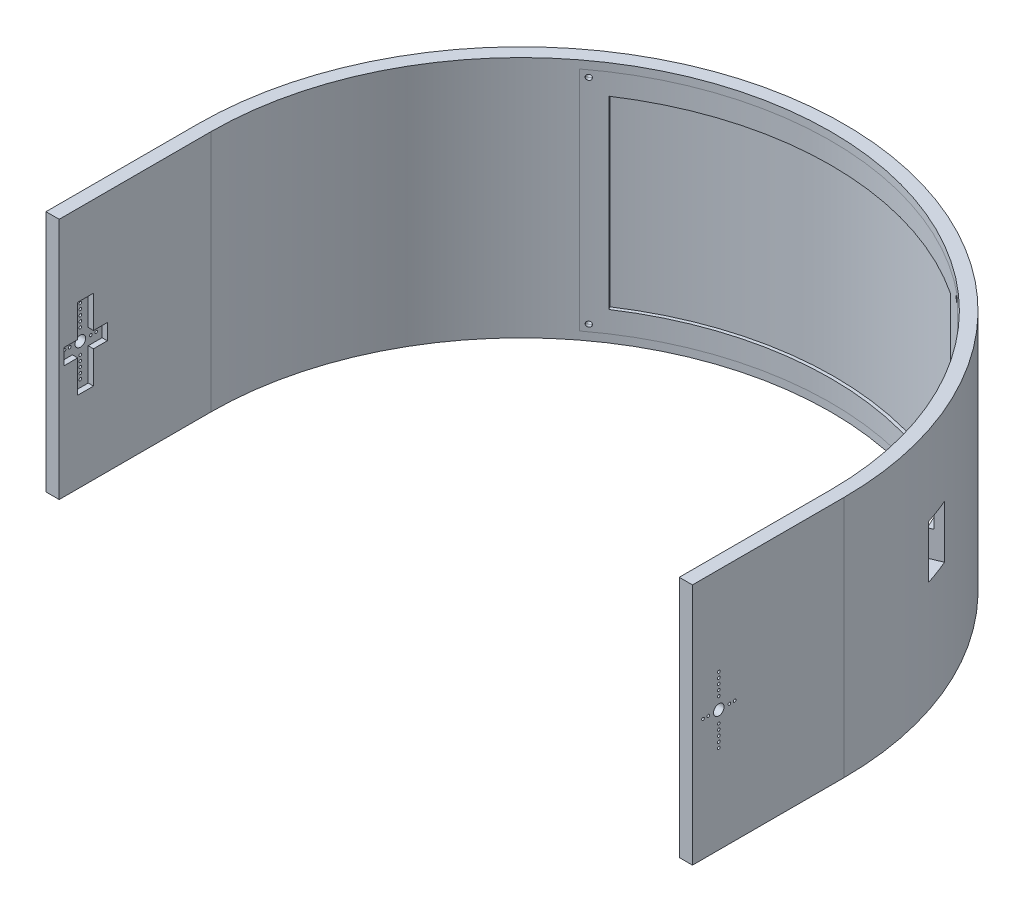
from build123d import *

# Parameters (mm, degrees)
BOSS_EXTRUDE1_DEPTH     = 46
SKETCH2_R               = 2
SKETCH2_R_2             = 0.5
CUT_EXTRUDE1_DEPTH      = 302.730011765
CUT_EXTRUDE2_START      = -2
CUT_EXTRUDE2_DEPTH      = 239
CUT_EXTRUDE3_DEPTH      = 38
CUT_EXTRUDE4_DEPTH      = 28
CUT_EXTRUDE5_DEPTH      = 10
CUT_EXTRUDE6_DEPTH      = 20
CUT_EXTRUDE7_DEPTH      = 43
CUT_EXTRUDE7_DEPTH_BACK = 43
CUT_EXTRUDE8_DEPTH      = 260.102171047
CUT_EXTRUDE8_DEPTH_BACK = 260.102171047
SKETCH9_R               = 1
CUT_EXTRUDE9_DEPTH      = 261.319003152
CUT_EXTRUDE9_DEPTH_BACK = 261.319003152
SKETCH10_R              = 1
BOSS_EXTRUDE2_START     = -43
BOSS_EXTRUDE2_DEPTH     = 86
SKETCH12_R              = 1
CUT_EXTRUDE10_DEPTH     = 260.102171148
SKETCH13_R              = 1
CUT_EXTRUDE12_DEPTH     = 261.319003152
CUT_EXTRUDE13_DEPTH     = 35


with BuildPart() as part:
    # Sketch1 → Boss-Extrude1 (new, symmetric)
    with BuildSketch(Plane(origin=(0, 0, 0), x_dir=(1, 0, 0), z_dir=(0, 1, 0))):
        with BuildLine():
            Line((-117.5, -10), (-117.5, 10))
            Line((-117.5, 10), (-117.5, 47.5))
            ThreePointArc((-117.5, 47.5), (0, 165), (117.5, 47.5))
            Line((117.5, 47.5), (117.5, 10))
            Line((117.5, 10), (117.5, -10))
            Line((117.5, -10), (122.5, -10))
            Line((122.5, -10), (122.5, 47.5))
            ThreePointArc((122.5, 47.5), (0, 170), (-122.5, 47.5))
            Line((-122.5, 47.5), (-122.5, -10))
            Line((-122.5, -10), (-117.5, -10))
        make_face()
    extrude(amount=BOSS_EXTRUDE1_DEPTH, both=True)

    # Sketch2 → Cut-Extrude1 (cut, through all)
    with BuildSketch(Plane.ZY.offset(122.5)):
        Circle(SKETCH2_R)
        with Locations((4, 0)):
            Circle(SKETCH2_R_2)
        with Locations((6, 0)):
            Circle(SKETCH2_R_2)
        with Locations((-6, 0)):
            Circle(SKETCH2_R_2)
        with Locations((-4, 0)):
            Circle(SKETCH2_R_2)
        with Locations((0, 4.5)):
            Circle(SKETCH2_R_2)
        with Locations((0, 6.5)):
            Circle(SKETCH2_R_2)
        with Locations((0, 8.5)):
            Circle(SKETCH2_R_2)
        with Locations((0, 10.5)):
            Circle(SKETCH2_R_2)
        with Locations((0, 12.5)):
            Circle(SKETCH2_R_2)
        with Locations((0, -12.5)):
            Circle(SKETCH2_R_2)
        with Locations((0, -10.5)):
            Circle(SKETCH2_R_2)
        with Locations((0, -8.5)):
            Circle(SKETCH2_R_2)
        with Locations((0, -6.5)):
            Circle(SKETCH2_R_2)
        with Locations((0, -4.5)):
            Circle(SKETCH2_R_2)
    extrude(amount=-CUT_EXTRUDE1_DEPTH, mode=Mode.SUBTRACT)

    # Sketch3 → Cut-Extrude2 (cut)
    with BuildSketch(Plane(origin=(-117.5, 0, 0), x_dir=(0, 0, -1), z_dir=(1, 0, 0)).offset(CUT_EXTRUDE2_START)):
        Polygon((-8.25, 3), (-8.25, -3), (-3, -3), (-3, -15.25), (3, -15.25), (3, -3), (8.25, -3), (8.25, 3), (3, 3), (3, 15.25), (-3, 15.25), (-3, 3), align=None)
    extrude(amount=CUT_EXTRUDE2_DEPTH, mode=Mode.SUBTRACT)

    # Sketch4 → Cut-Extrude3 (cut, symmetric)
    with BuildSketch(Plane(origin=(0, 0, 0), x_dir=(1, 0, 0), z_dir=(0, 1, 0))):
        with BuildLine():
            Line((72.452324792, 142.531103499), (71.239733582, 140.940624779))
            ThreePointArc((71.239733582, 140.940624779), (68.016460422, 143.312374523), (64.714290943, 145.572985821))
            ThreePointArc((64.714290943, 145.572985821), (0, 165), (-64.714290943, 145.572985821))
            ThreePointArc((-64.714290943, 145.572985821), (-65.961608967, 144.738449918), (-67.198166488, 143.888051234))
            Line((-67.198166488, 143.888051234), (-68.341965066, 145.528698914))
            ThreePointArc((-68.341965066, 145.528698914), (-67.084359758, 146.39357247), (-65.815810789, 147.242313239))
            ThreePointArc((-65.815810789, 147.242313239), (0, 167), (65.815810789, 147.242313239))
            ThreePointArc((65.815810789, 147.242313239), (69.174187408, 144.943223451), (72.452324792, 142.531103499))
        make_face()
    extrude(amount=CUT_EXTRUDE3_DEPTH, both=True, mode=Mode.SUBTRACT)

    # Sketch5 → Cut-Extrude4 (cut, symmetric)
    with BuildSketch(Plane(origin=(0, 0, 0), x_dir=(1, 0, 0), z_dir=(0, 1, 0))):
        with BuildLine():
            Line((71.239733582, 140.940624779), (72.452324792, 142.531103499))
            ThreePointArc((72.452324792, 142.531103499), (85.046099883, 131.448858805), (95.963880823, 118.712243171))
            Line((95.963880823, 118.712243171), (94.357790767, 117.520406465))
            ThreePointArc((94.357790767, 117.520406465), (83.622734194, 130.043856984), (71.239733582, 140.940624779))
        make_face()
    extrude(amount=CUT_EXTRUDE4_DEPTH, both=True, mode=Mode.SUBTRACT)

    # Sketch6 → Cut-Extrude5 (cut)
    with BuildSketch(Plane(origin=(0, 16, 0), x_dir=(-1, 0, 0), z_dir=(0, -1, 0))):
        with BuildLine():
            Line((-94.357790767, 117.520406465), (-95.963880823, 118.712243171))
            ThreePointArc((-95.963880823, 118.712243171), (-103.751897156, 106.794129866), (-110.067253578, 94.034392549))
            Line((-110.067253578, 94.034392549), (-108.225123811, 93.255574264))
            ThreePointArc((-108.225123811, 93.255574264), (-102.015463731, 105.801759492), (-94.357790767, 117.520406465))
        make_face()
    extrude(amount=CUT_EXTRUDE5_DEPTH, mode=Mode.SUBTRACT)

    # Sketch7 → Cut-Extrude6 (cut)
    with BuildSketch(Plane(origin=(0, 16, 0), x_dir=(-1, 0, 0), z_dir=(0, -1, 0))):
        with BuildLine():
            Line((-108.225123811, 93.255574264), (-112.830448228, 95.202619977))
            ThreePointArc((-112.830448228, 95.202619977), (-114.758519616, 90.357113478), (-116.478609813, 85.433935416))
            Line((-116.478609813, 85.433935416), (-111.724380841, 83.885611521))
            ThreePointArc((-111.724380841, 83.885611521), (-110.074498407, 88.60784354), (-108.225123811, 93.255574264))
        make_face()
    extrude(amount=CUT_EXTRUDE6_DEPTH, mode=Mode.SUBTRACT)

    # Sketch8 → Cut-Extrude7 (cut, two sides: drawn at the far end of the back side and taken through both)
    with BuildSketch(Plane(origin=(0, 0, 0), x_dir=(1, 0, 0), z_dir=(0, 1, 0)).offset(-CUT_EXTRUDE7_DEPTH_BACK)):
        with BuildLine():
            Line((-71.239733582, 140.940624779), (-71.997603088, 141.934673979))
            ThreePointArc((-71.997603088, 141.934673979), (2.527686356, 166.223095064), (75.951681607, 138.784744405))
            Line((75.951681607, 138.784744405), (75.152190222, 137.823852359))
            ThreePointArc((75.152190222, 137.823852359), (2.501079131, 164.973378274), (-71.239733582, 140.940624779))
        make_face()
    extrude(amount=CUT_EXTRUDE7_DEPTH + CUT_EXTRUDE7_DEPTH_BACK, mode=Mode.SUBTRACT)

    # Sketch9 → Cut-Extrude8 (cut, two sides: drawn at the far end of the back side and taken through both)
    with BuildSketch(Plane(origin=(-92.584869702, 0, -126.95413052), x_dir=(0.8079646588946356, 0, -0.589230947912001), z_dir=(0.5892309479120009, 0, 0.8079646588946355)).offset(-CUT_EXTRUDE8_DEPTH_BACK)):
        with Locations((27.988470026, 40.5)):
            Circle(SKETCH9_R)
        with Locations((28.009755806, -40.5)):
            Circle(SKETCH9_R)
    extrude(amount=CUT_EXTRUDE8_DEPTH + CUT_EXTRUDE8_DEPTH_BACK, mode=Mode.SUBTRACT)

    # Sketch10 → Cut-Extrude9 (cut, two sides: drawn at the far end of the back side and taken through both)
    with BuildSketch(Plane(origin=(97.140467622, 0, -121.939563178), x_dir=(0.7821537093655259, 0, 0.6230855277774864), z_dir=(-0.6230855277774864, 0, 0.7821537093655259)).offset(-CUT_EXTRUDE9_DEPTH_BACK)):
        with Locations((-29.609866182, 40.5)):
            Circle(SKETCH10_R)
        with Locations((-29.609866182, -40.5)):
            Circle(SKETCH10_R)
    extrude(amount=CUT_EXTRUDE9_DEPTH + CUT_EXTRUDE9_DEPTH_BACK, mode=Mode.SUBTRACT)


with BuildPart() as body_2:
    # Sketch11 → Boss-Extrude2 (new body)
    with BuildSketch(Plane(origin=(0, 0, 0), x_dir=(1, 0, 0), z_dir=(0, 1, 0)).offset(BOSS_EXTRUDE2_START)):
        with BuildLine():
            Line((-71.997603088, 141.934673979), (-71.239733582, 140.940624779))
            ThreePointArc((-71.239733582, 140.940624779), (2.501079131, 164.973378274), (75.152190222, 137.823852359))
            Line((75.152190222, 137.823852359), (75.951681607, 138.784744405))
            ThreePointArc((75.951681607, 138.784744405), (2.527686356, 166.223095064), (-71.997603088, 141.934673979))
        make_face()
    extrude(amount=BOSS_EXTRUDE2_DEPTH)

    # Sketch12 → Cut-Extrude10 (cut, through all)
    with BuildSketch(Plane(origin=(-92.584869702, 0, -126.95413052), x_dir=(0.8079646588946356, 0, -0.589230947912001), z_dir=(0.5892309479120009, 0, 0.8079646588946355))):
        with Locations(Location((27.988470026, 40.5, 0), (0, 0, 180))):
            Circle(SKETCH12_R)
        with Locations(Location((28.009755806, -40.5, 0), (0, 0, 180))):
            Circle(SKETCH12_R)
    extrude(amount=CUT_EXTRUDE10_DEPTH, mode=Mode.SUBTRACT)

    # Sketch13 → Cut-Extrude12 (cut, through all)
    with BuildSketch(Plane(origin=(97.140467622, 0, -121.939563178), x_dir=(0.7821537093655259, 0, 0.6230855277774864), z_dir=(-0.6230855277774864, 0, 0.7821537093655259))):
        with Locations(Location((-29.609866182, 40.5, 0), (0, 0, 180))):
            Circle(SKETCH13_R)
        with Locations(Location((-29.609866182, -40.5, 0), (0, 0, 180))):
            Circle(SKETCH13_R)
    extrude(amount=CUT_EXTRUDE12_DEPTH, mode=Mode.SUBTRACT)

    # Sketch14 → Cut-Extrude13 (cut, symmetric)
    with BuildSketch(Plane(origin=(0, 0, 0), x_dir=(1, 0, 0), z_dir=(0, 1, 0))):
        with BuildLine():
            Line((-65.402740846, 146.616315457), (-64.714290943, 145.572985821))
            ThreePointArc((-64.714290943, 145.572985821), (0, 165), (64.714290943, 145.572985821))
            Line((64.714290943, 145.572985821), (65.402740846, 146.616315457))
            ThreePointArc((65.402740846, 146.616315457), (0, 166.25), (-65.402740846, 146.616315457))
        make_face()
    extrude(amount=CUT_EXTRUDE13_DEPTH, both=True, mode=Mode.SUBTRACT)


solid = Compound([part.part, body_2.part])
